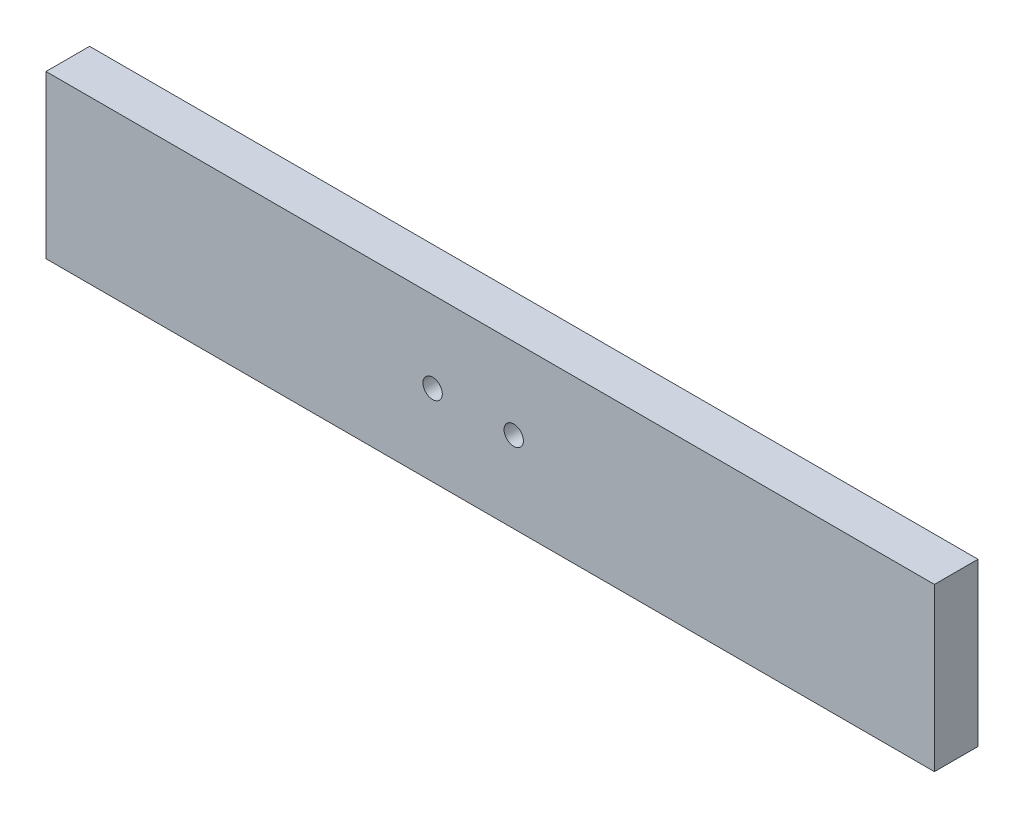
from build123d import *

# Parameters (mm, degrees)
SKETCH1_W           = 367
SKETCH1_H           = 67
SKETCH1_R           = 4
BOSS_EXTRUDE1_DEPTH = 18


with BuildPart() as part:
    # Sketch1 → Boss-Extrude1 (new body)
    with BuildSketch(Plane.XY):
        with Locations((-150.761625266, -31.382788069)):
            Rectangle(SKETCH1_W, SKETCH1_H)
        with Locations((-174.551197831, -31.382788069)):
            Circle(SKETCH1_R, mode=Mode.SUBTRACT)
        with Locations((-141.051197831, -31.382788069)):
            Circle(SKETCH1_R, mode=Mode.SUBTRACT)
    extrude(amount=BOSS_EXTRUDE1_DEPTH)


solid = part.part
